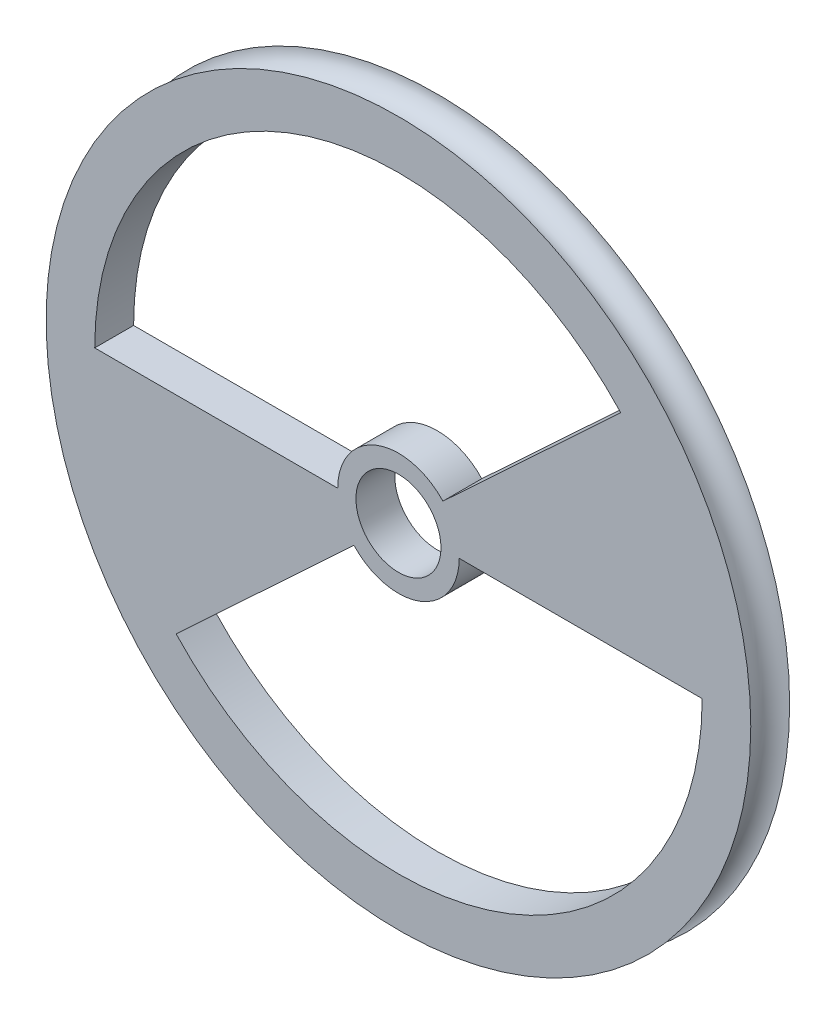
from build123d import *

# Parameters (mm, degrees)
SKETCH1_R           = 29
SKETCH1_R_2         = 25
SKETCH1_R_3         = 5
SKETCH1_R_4         = 3.5
BOSS_EXTRUDE3_DEPTH = 3.2


with BuildPart() as part:
    # Sketch1 → Boss-Extrude3 (new body)
    # profile 1 of 4: a face of its own
    with BuildSketch(Plane.XY):
        Circle(SKETCH1_R)
        Circle(SKETCH1_R_2, mode=Mode.SUBTRACT)
    # profile 2 of 4: a face of its own
    with BuildSketch(Plane.XY):
        with BuildLine():
            Line((18.29985715, 17.032769249), (3.65997143, 3.40655385))
            ThreePointArc((3.65997143, 3.40655385), (4.652948374, 1.830320034), (5, 0))
            Line((5, 0), (25, 0))
            ThreePointArc((25, 0), (23.264741872, 9.151600168), (18.29985715, 17.032769249))
        make_face()
    # profile 3 of 4: a face of its own
    with BuildSketch(Plane.XY):
        with BuildLine():
            ThreePointArc((-3.65997143, -3.40655385), (-4.652948374, -1.830320034), (-5, 0))
            Line((-5, 0), (-25, 0))
            ThreePointArc((-25, 0), (-23.264741872, -9.151600168), (-18.29985715, -17.032769249))
            Line((-18.29985715, -17.032769249), (-3.65997143, -3.40655385))
        make_face()
    # profile 4 of 4: a face of its own
    with BuildSketch(Plane.XY):
        Circle(SKETCH1_R_3)
        Circle(SKETCH1_R_4, mode=Mode.SUBTRACT)
    extrude(amount=BOSS_EXTRUDE3_DEPTH)

    # Sketch6 → Cut-Revolve4 (revolve, cut)
    with BuildSketch(Plane(origin=(0, 0, 0), x_dir=(0, 0, -1), z_dir=(1, 0, 0)), mode=Mode.PRIVATE) as cut_revolve4_sk:
        with BuildLine():
            Line((0, 29), (-3.2, 29))
            ThreePointArc((-3.2, 29), (-1.6, 27.4), (0, 29))
        make_face()
    revolve(cut_revolve4_sk.sketch.rotate(Axis((0, 0, 3.2), (0, 0, -1)), 90), axis=Axis((0, 0, 3.2), (0, 0, -1)), mode=Mode.SUBTRACT)


solid = part.part
